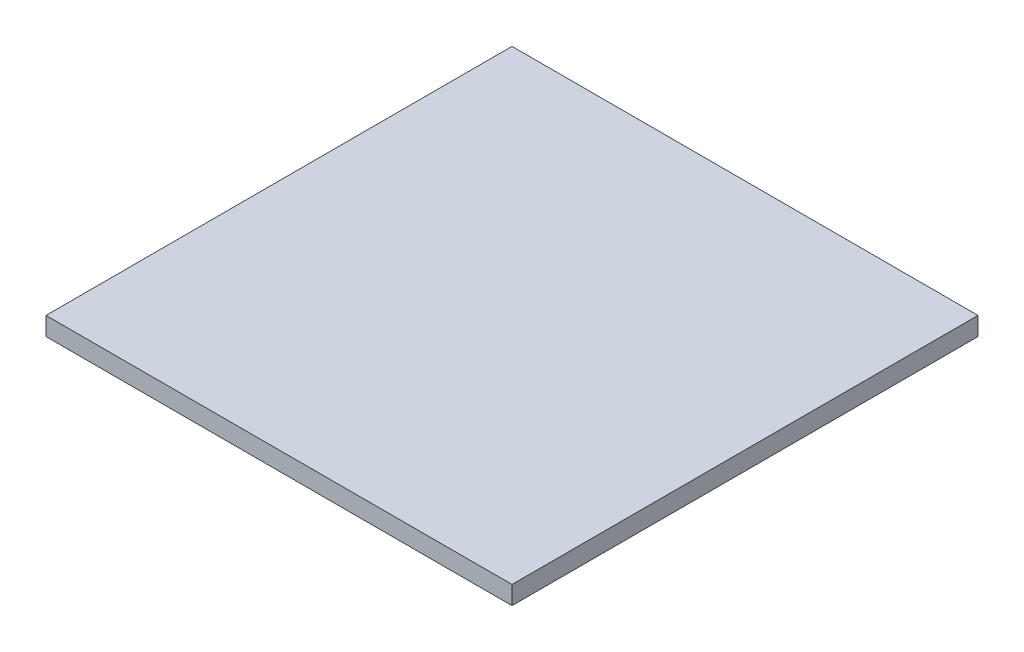
from build123d import *

# Parameters (mm, degrees)
SKETCH1_W           = 12.7
SKETCH1_H           = 12.7
BOSS_EXTRUDE1_DEPTH = 0.5


with BuildPart() as part:
    # Sketch1 → Boss-Extrude1 (new body)
    with BuildSketch(Plane(origin=(0, 0, 0), x_dir=(1, 0, 0), z_dir=(0, 1, 0))):
        with Locations((6.35, 6.35)):
            Rectangle(SKETCH1_W, SKETCH1_H)
    extrude(amount=BOSS_EXTRUDE1_DEPTH)


solid = part.part
